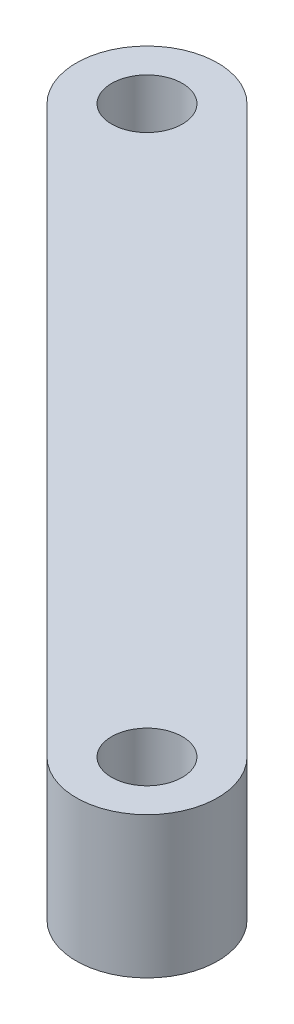
from build123d import *

# Parameters (mm, degrees)
BOSS_EXTRUDE1_DEPTH = 5
SKETCH2_R           = 1.25
CUT_EXTRUDE1_DEPTH  = 19.371173071


with BuildPart() as part:
    # Sketch1 → Boss-Extrude1 (new body)
    with BuildSketch(Plane(origin=(0, 0, 0), x_dir=(1, 0, 0), z_dir=(0, 1, 0))):
        with BuildLine():
            Line((-11.767766953, 8.232233047), (8.232233047, -11.767766953))
            ThreePointArc((8.232233047, -11.767766953), (11.767766953, -11.767766953), (11.767766953, -8.232233047))
            Line((11.767766953, -8.232233047), (-8.232233047, 11.767766953))
            ThreePointArc((-8.232233047, 11.767766953), (-11.767766953, 11.767766953), (-11.767766953, 8.232233047))
        make_face()
    extrude(amount=BOSS_EXTRUDE1_DEPTH)

    # Sketch2 → Cut-Extrude1 (cut, through all)
    with BuildSketch(Plane(origin=(0, 5, 0), x_dir=(1, 0, 0), z_dir=(0, 1, 0))):
        with Locations(Location((-10, 10, 0), (0, 0, 270))):
            Circle(SKETCH2_R)
        with Locations(Location((10, -10, 0), (0, 0, 270))):
            Circle(SKETCH2_R)
    extrude(amount=-CUT_EXTRUDE1_DEPTH, mode=Mode.SUBTRACT)


solid = part.part
